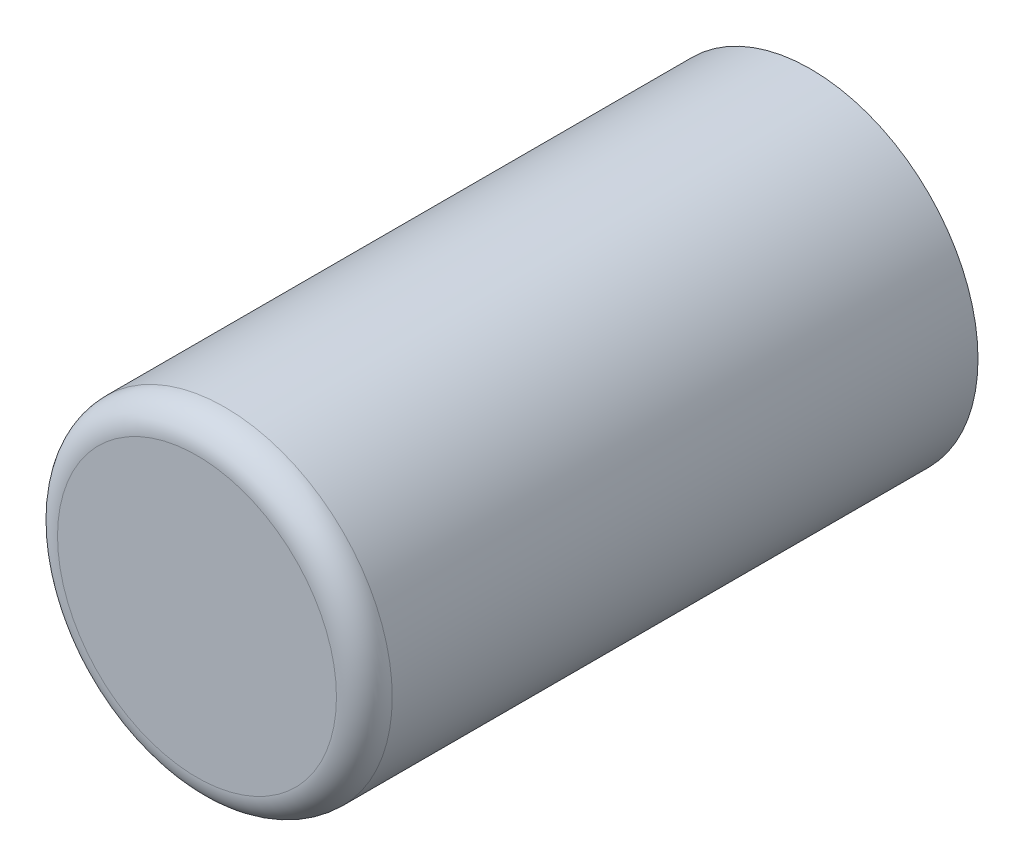
from build123d import *

# Parameters (mm, degrees)
SKETCH1_R           = 30
BOSS_EXTRUDE1_DEPTH = 110
FILLET1_R           = 5
SHELL1_T            = -1


with BuildPart() as part:
    # Sketch1 → Boss-Extrude1 (new body)
    with BuildSketch(Plane.XY):
        Circle(SKETCH1_R)
    extrude(amount=BOSS_EXTRUDE1_DEPTH)

    # Fillet1
    fillet1_edges = [part.edges().sort_by_distance(p)[0] for p in [
        (-30, 0, 110),
    ]]
    fillet(fillet1_edges, radius=FILLET1_R)

    # Shell1
    shell1_openings = [part.faces().sort_by_distance(p)[0] for p in [
        (0, 0, 0),
    ]]
    offset(amount=SHELL1_T, openings=shell1_openings, kind=Kind.INTERSECTION)


solid = part.part
